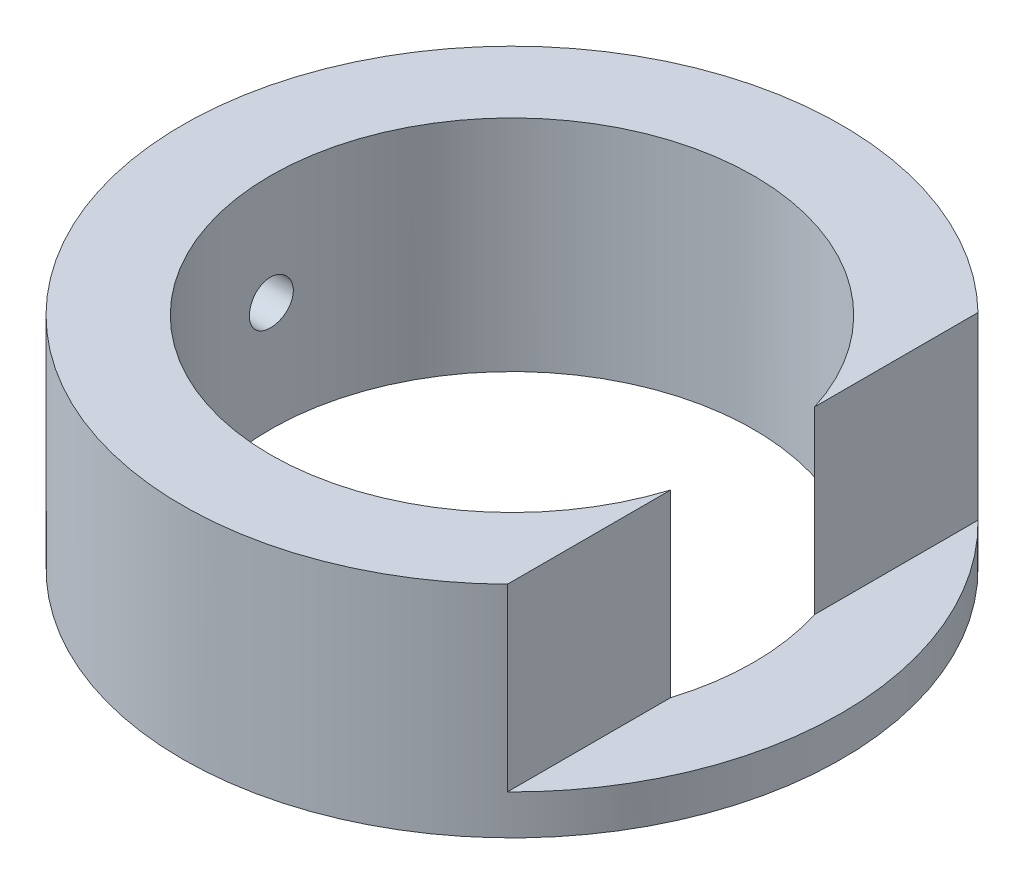
from build123d import *

# Parameters (mm, degrees)
SKETCH1_R           = 24
BOSS_EXTRUDE1_DEPTH = 8
SKETCH2_R           = 17.6
CUT_EXTRUDE1_DEPTH  = 16
CUT_EXTRUDE2_START  = -5.1
SKETCH3_W           = 10.2
SKETCH3_H           = 96
CUT_EXTRUDE2_DEPTH  = 15.1
SKETCH4_R           = 1.6
CUT_EXTRUDE3_DEPTH  = 60


with BuildPart() as part:
    # Sketch1 → Boss-Extrude1 (new, symmetric)
    with BuildSketch(Plane(origin=(0, 0, 0), x_dir=(1, 0, 0), z_dir=(0, 1, 0))):
        with Locations(Location((0, 0, 0), (0, 0, 270))):
            Circle(SKETCH1_R)
    extrude(amount=BOSS_EXTRUDE1_DEPTH, both=True)

    # Sketch2 → Cut-Extrude1 (cut, symmetric)
    with BuildSketch(Plane(origin=(0, 0, 0), x_dir=(1, 0, 0), z_dir=(0, 1, 0))):
        with Locations(Location((0, 0, 0), (0, 0, 270))):
            Circle(SKETCH2_R)
    extrude(amount=CUT_EXTRUDE1_DEPTH, both=True, mode=Mode.SUBTRACT)

    # Sketch3 → Cut-Extrude2 (cut)
    with BuildSketch(Plane(origin=(0, 0, 0), x_dir=(1, 0, 0), z_dir=(0, 1, 0)).offset(CUT_EXTRUDE2_START)):
        with Locations((21.9, 0)):
            Rectangle(SKETCH3_W, SKETCH3_H)
    extrude(amount=CUT_EXTRUDE2_DEPTH, mode=Mode.SUBTRACT)

    # Sketch4 → Cut-Extrude3 (cut, symmetric)
    with BuildSketch(Plane(origin=(0, 0, 0), x_dir=(0, 0, -1), z_dir=(1, 0, 0))):
        Circle(SKETCH4_R)
    extrude(amount=CUT_EXTRUDE3_DEPTH, both=True, mode=Mode.SUBTRACT)


solid = part.part
